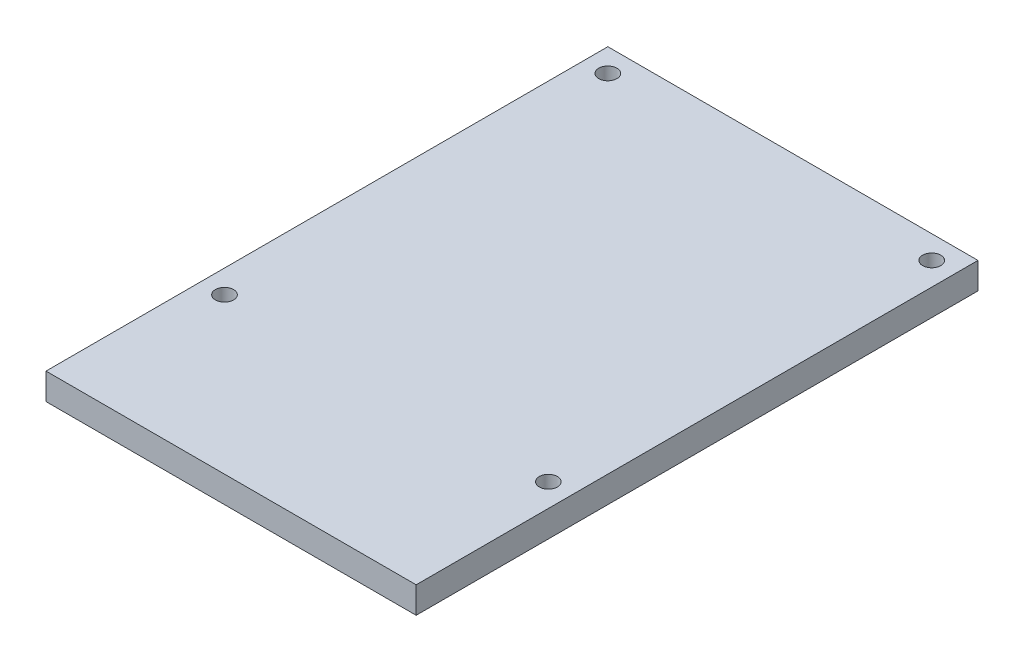
from build123d import *

# Parameters (mm, degrees)
SKETCH1_W           = 56
SKETCH1_H           = 85
BOSS_EXTRUDE1_DEPTH = 4
SKETCH2_R           = 1.375
CUT_EXTRUDE1_DEPTH  = 4


with BuildPart() as part:
    # Sketch1 → Boss-Extrude1 (new body)
    with BuildSketch(Plane(origin=(0, 0, 0), x_dir=(1, 0, 0), z_dir=(0, 1, 0))):
        with Locations((28, 42.5)):
            Rectangle(SKETCH1_W, SKETCH1_H)
    extrude(amount=BOSS_EXTRUDE1_DEPTH)

    # Sketch2 → Cut-Extrude1 (cut)
    with BuildSketch(Plane(origin=(0, 4, 0), x_dir=(1, 0, 0), z_dir=(0, 1, 0))):
        with Locations(Location((3.5, 81.5, 0), (0, 0, 270))):
            Circle(SKETCH2_R)
        with Locations(Location((52.5, 81.5, 0), (0, 0, 270))):
            Circle(SKETCH2_R)
        with Locations(Location((3.5, 23.5, 0), (0, 0, 270))):
            Circle(SKETCH2_R)
        with Locations(Location((52.5, 23.5, 0), (0, 0, 270))):
            Circle(SKETCH2_R)
    extrude(amount=-CUT_EXTRUDE1_DEPTH, mode=Mode.SUBTRACT)


solid = part.part
